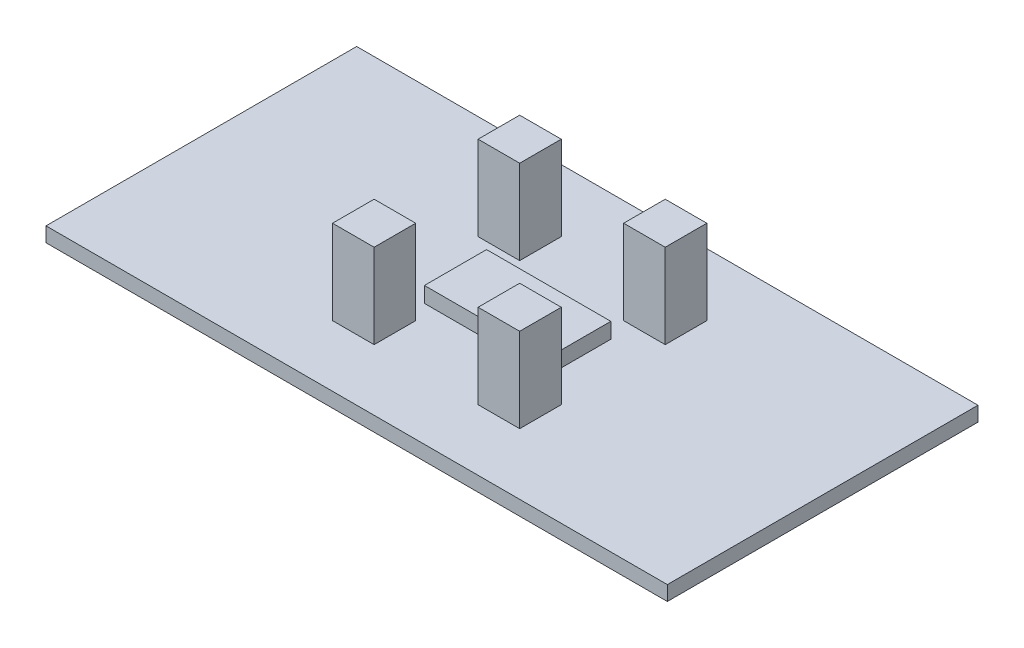
from build123d import *

# Parameters (mm, degrees)
SKETCH1_W             = 508
SKETCH1_H             = 254
BOSS_EXTRUDE1_DEPTH   = 12
SKETCH2_W             = 34
SKETCH2_H             = 34
BOSS_EXTRUDE2_DEPTH   = 69
BOSS_EXTRUDE2_2_DEPTH = 69
BOSS_EXTRUDE2_3_DEPTH = 69
BOSS_EXTRUDE2_4_DEPTH = 69
SKETCH3_W             = 101.6
SKETCH3_H             = 50.8
BOSS_EXTRUDE3_DEPTH   = 12.7


with BuildPart() as part:
    # Sketch1 → Boss-Extrude1 (new body)
    with BuildSketch(Plane(origin=(0, 0, 0), x_dir=(1, 0, 0), z_dir=(0, 1, 0))):
        with Locations((-33.866666667, 4.838095238)):
            Rectangle(SKETCH1_W, SKETCH1_H)
    extrude(amount=BOSS_EXTRUDE1_DEPTH)

    # Sketch3 → Boss-Extrude3 (add)
    with BuildSketch(Plane(origin=(0, 12, 0), x_dir=(1, 0, 0), z_dir=(0, 1, 0))):
        with Locations((-27.461335597, 3.038095238)):
            Rectangle(SKETCH3_W, SKETCH3_H)
    extrude(amount=BOSS_EXTRUDE3_DEPTH)


with BuildPart() as body_2:
    # Sketch2 → Boss-Extrude2 (new body)
    with BuildSketch(Plane(origin=(0, 12, 0), x_dir=(1, 0, 0), z_dir=(0, 1, 0))):
        with Locations((-86.596666667, 63.838095238)):
            Rectangle(SKETCH2_W, SKETCH2_H)
    extrude(amount=BOSS_EXTRUDE2_DEPTH)


with BuildPart() as body_3:
    # Sketch2 → Boss-Extrude2 2 (new body)
    with BuildSketch(Plane(origin=(0, 12, 0), x_dir=(1, 0, 0), z_dir=(0, 1, 0))):
        with Locations((32.403333333, 63.838095238)):
            Rectangle(SKETCH2_W, SKETCH2_H)
    extrude(amount=BOSS_EXTRUDE2_2_DEPTH)


with BuildPart() as body_4:
    # Sketch2 → Boss-Extrude2 3 (new body)
    with BuildSketch(Plane(origin=(0, 12, 0), x_dir=(1, 0, 0), z_dir=(0, 1, 0))):
        with Locations((-86.596666667, -55.161904762)):
            Rectangle(SKETCH2_W, SKETCH2_H)
    extrude(amount=BOSS_EXTRUDE2_3_DEPTH)


with BuildPart() as body_5:
    # Sketch2 → Boss-Extrude2 4 (new body)
    with BuildSketch(Plane(origin=(0, 12, 0), x_dir=(1, 0, 0), z_dir=(0, 1, 0))):
        with Locations((32.403333333, -55.161904762)):
            Rectangle(SKETCH2_W, SKETCH2_H)
    extrude(amount=BOSS_EXTRUDE2_4_DEPTH)


solid = Compound([part.part, body_2.part, body_3.part, body_4.part, body_5.part])
